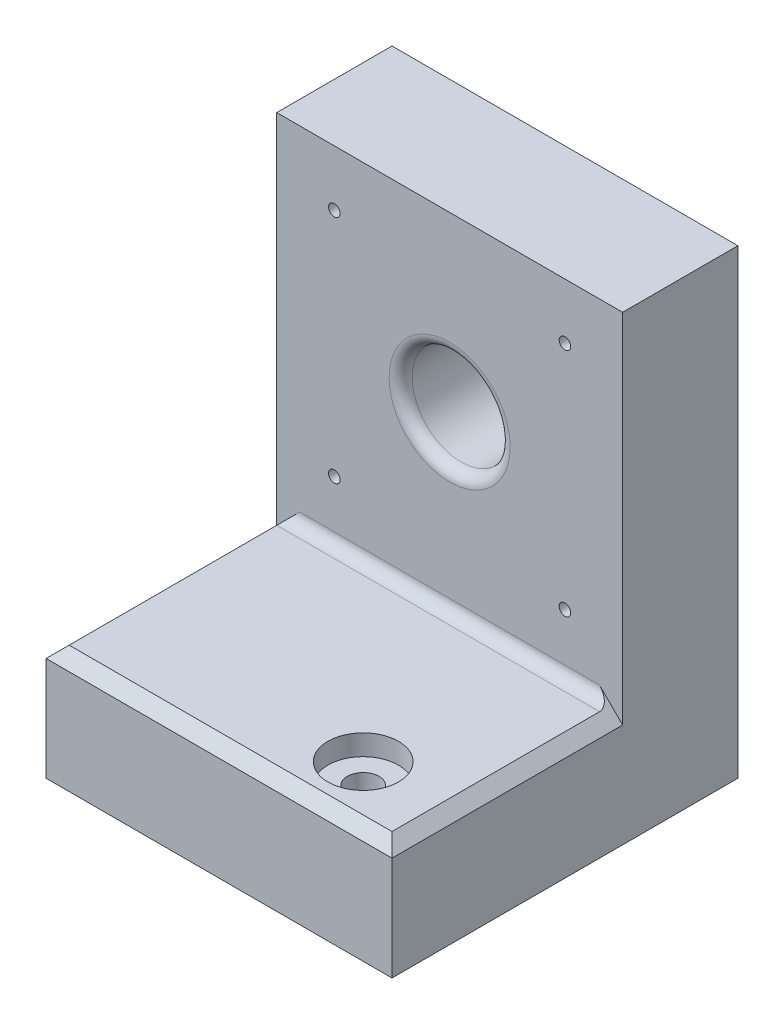
from build123d import *

# Parameters (mm, degrees)
BOSS_EXTRUDE1_DEPTH = 60
SKETCH2_R           = 8.5
CUT_EXTRUDE1_DEPTH  = 108.703296143
FILLET1_R           = 2
SKETCH3_R           = 1
CUT_EXTRUDE2_DEPTH  = 10
SKETCH5_R           = 6.12
CUT_EXTRUDE3_DEPTH  = 3.58
SKETCH6_R           = 2.75
CUT_EXTRUDE4_DEPTH  = 107.030261718
CHAMFER1_SIZE       = 2
FILLET2_R           = 2


with BuildPart() as part:
    # Sketch1 → Boss-Extrude1 (new body)
    with BuildSketch(Plane(origin=(0, 0, 0), x_dir=(0, 0, -1), z_dir=(1, 0, 0))):
        Polygon((0, 0), (0, 80), (-20, 80), (-20, 20), (-60, 20), (-60, 0), align=None)
    extrude(amount=BOSS_EXTRUDE1_DEPTH)

    # Sketch2 → Cut-Extrude1 (cut, through all)
    with BuildSketch(Plane.XY.offset(20)):
        with Locations((30, 50)):
            Circle(SKETCH2_R)
    extrude(amount=-CUT_EXTRUDE1_DEPTH, mode=Mode.SUBTRACT)

    # Fillet1
    fillet1_edges = [part.edges().sort_by_distance(p)[0] for p in [
        (21.5, 50, 0),
        (21.5, 50, 20),
    ]]
    fillet(fillet1_edges, radius=FILLET1_R)

    # Sketch3 → Cut-Extrude2 (cut)
    with BuildSketch(Plane.XY.offset(20)):
        with Locations((10, 70.338969999)):
            Circle(SKETCH3_R)
        with Locations((50, 70.338969999)):
            Circle(SKETCH3_R)
        with Locations((50, 30.338969999)):
            Circle(SKETCH3_R)
        with Locations((10, 30.338969999)):
            Circle(SKETCH3_R)
    extrude(amount=-CUT_EXTRUDE2_DEPTH, mode=Mode.SUBTRACT)

    # Sketch5 → Cut-Extrude3 (cut)
    with BuildSketch(Plane(origin=(0, 20, 0), x_dir=(1, 0, 0), z_dir=(0, 1, 0))):
        with Locations(Location((45, -50, 0), (0, 0, 270))):
            Circle(SKETCH5_R)
    extrude(amount=-CUT_EXTRUDE3_DEPTH, mode=Mode.SUBTRACT)

    # Sketch6 → Cut-Extrude4 (cut, through all)
    with BuildSketch(Plane(origin=(0, 16.42, 0), x_dir=(1, 0, 0), z_dir=(0, 1, 0))):
        with Locations(Location((45, -50, 0), (0, 0, 270))):
            Circle(SKETCH6_R)
    extrude(amount=-CUT_EXTRUDE4_DEPTH, mode=Mode.SUBTRACT)

    # Chamfer1
    chamfer1_edges = [part.edges().sort_by_distance(p)[0] for p in [
        (30, 20, 60),
        (60, 20, 40),
        (0, 20, 40),
    ]]
    chamfer(chamfer1_edges, length=CHAMFER1_SIZE)

    # Fillet2
    fillet2_edges = [part.edges().sort_by_distance(p)[0] for p in [
        (30, 20, 20),
    ]]
    fillet(fillet2_edges, radius=FILLET2_R)


solid = part.part
